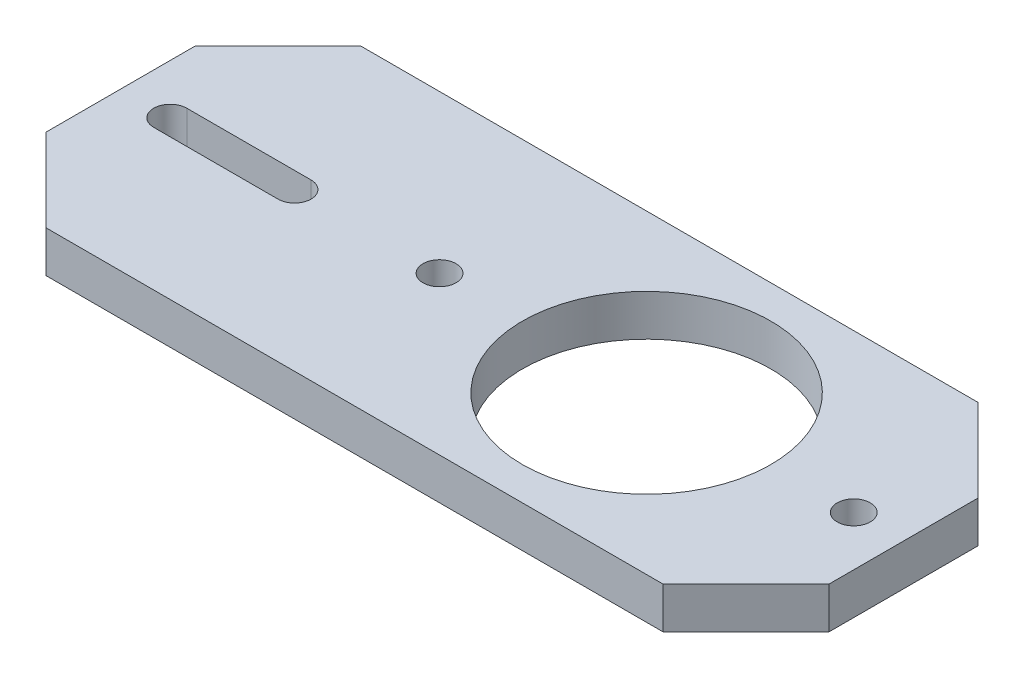
from build123d import *

# Parameters (mm, degrees)
SKETCH1_R           = 2
SKETCH1_R_2         = 15
BOSS_EXTRUDE1_DEPTH = 5


with BuildPart() as part:
    # Sketch1 → Boss-Extrude1 (new body)
    with BuildSketch(Plane(origin=(0, 0, 0), x_dir=(1, 0, 0), z_dir=(0, 1, 0))):
        Polygon((-63.5, 9), (-53.5, 19), (21, 19), (31, 9), (31, -9), (21, -19), (-53.5, -19), (-63.5, -9), align=None)
        with Locations(Location((-25, 0, 0), (0, 0, 270))):
            Circle(SKETCH1_R, mode=Mode.SUBTRACT)
        with Locations(Location((25, 0, 0), (0, 0, 270))):
            Circle(SKETCH1_R, mode=Mode.SUBTRACT)
        with Locations(Location((0, 0, 0), (0, 0, 270))):
            Circle(SKETCH1_R_2, mode=Mode.SUBTRACT)
        with BuildLine():
            Line((-57.5, 2), (-42.5, 2))
            ThreePointArc((-42.5, 2), (-40.5, 0), (-42.5, -2))
            Line((-42.5, -2), (-57.5, -2))
            ThreePointArc((-57.5, -2), (-59.5, 0), (-57.5, 2))
        make_face(mode=Mode.SUBTRACT)
    extrude(amount=-BOSS_EXTRUDE1_DEPTH)


solid = part.part
